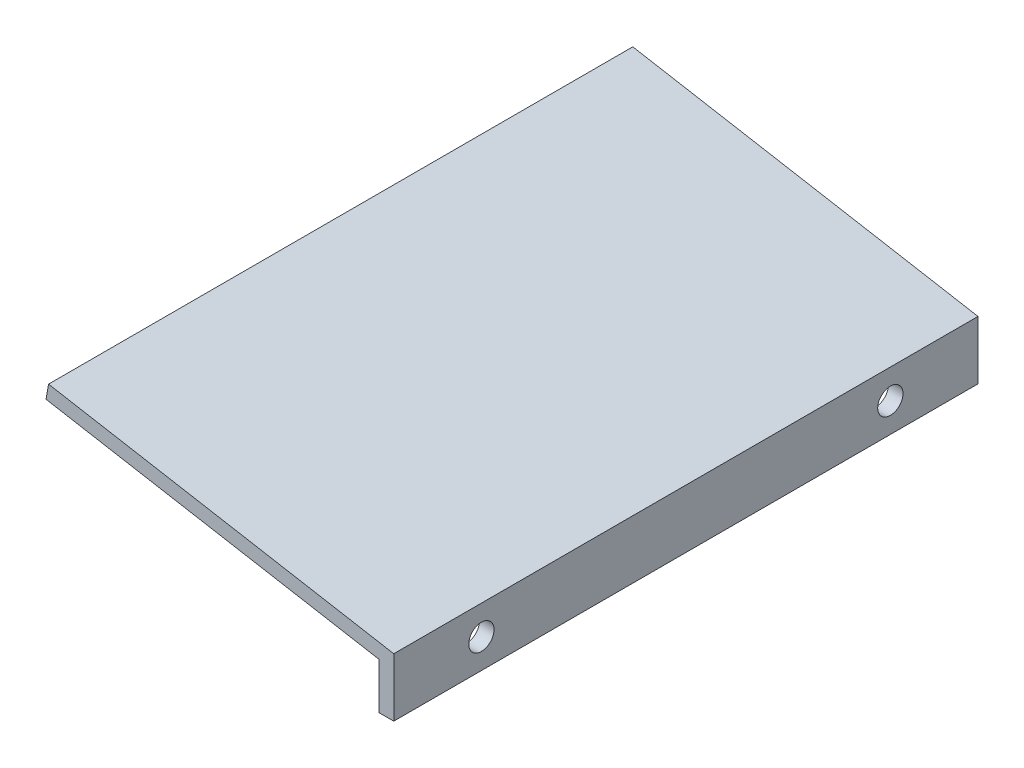
from build123d import *

# Parameters (mm, degrees)
BOSS_EXTRUDE1_DEPTH  = 127
M5_CLEARANCE_HOLE1_D = 5.5


with BuildPart() as part:
    # Sketch1 → Boss-Extrude1 (new body)
    with BuildSketch(Plane.XY):
        Polygon((0, 0), (0, 10.035858671), (-72.418683744, 22.805226522), (-71.86735078, 25.931991138), (3.175, 12.7), (3.175, 0), align=None)
    extrude(amount=BOSS_EXTRUDE1_DEPTH)

    # M5 Clearance Hole1 (through all)
    with Locations(Plane(origin=(3.175, 0, 0), x_dir=(0, 0, -1), z_dir=(1, 0, 0))):
        with Locations((-107.95, 6.35), (-19.05, 6.35)):
            Hole(M5_CLEARANCE_HOLE1_D / 2)


solid = part.part
